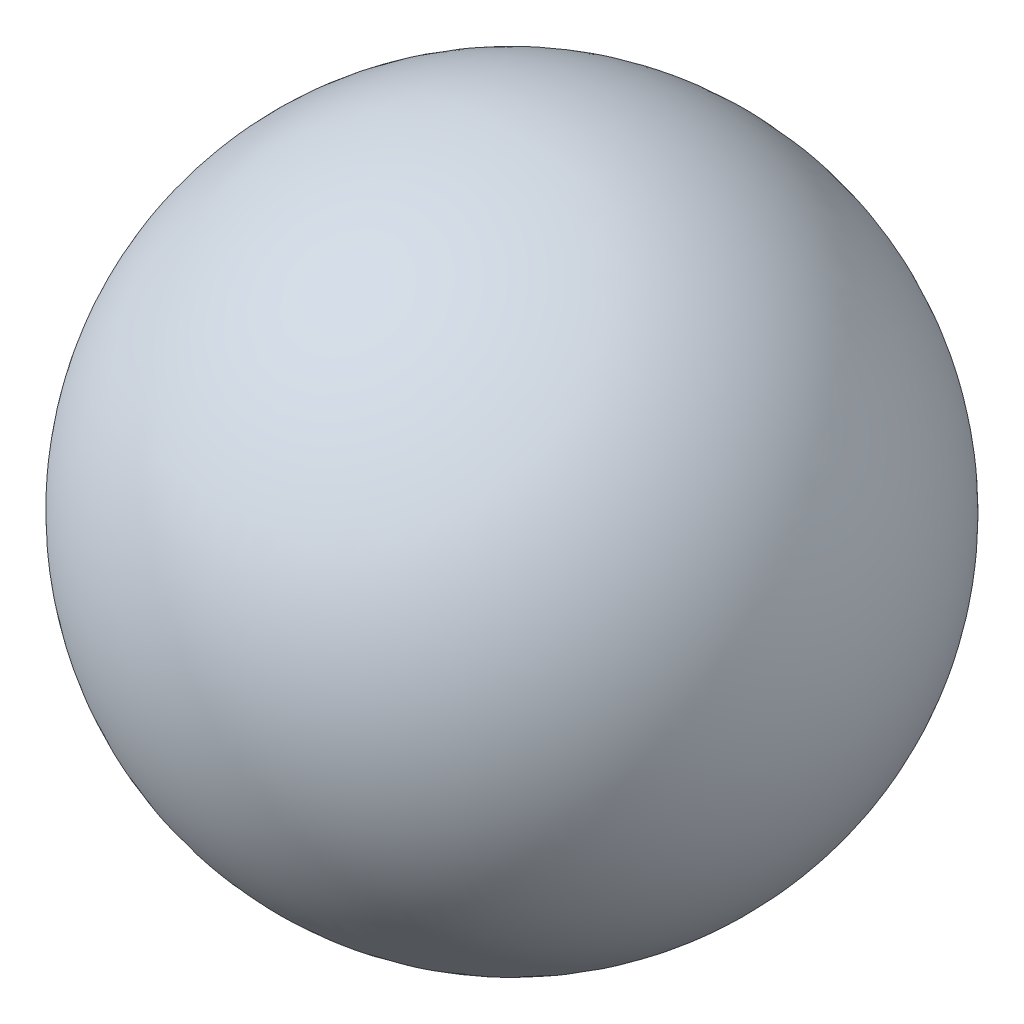
from build123d import *


with BuildPart() as part:
    # Sketch1 → Revolve1 (revolve)
    with BuildSketch(Plane(origin=(0, 0, 0), x_dir=(1, 0, 0), z_dir=(0, 1, 0))):
        with BuildLine():
            Line((-31.748011404, 0.355347566), (31.75, 0))
            ThreePointArc((31.75, 0), (0.177676565, 31.749502847), (-31.748011404, 0.355347566))
        make_face()
    revolve(axis=Axis((-31.748011404, 0, -0.355347566), (0.9999843416409989, 0, 0.005596112294998989)))


solid = part.part
